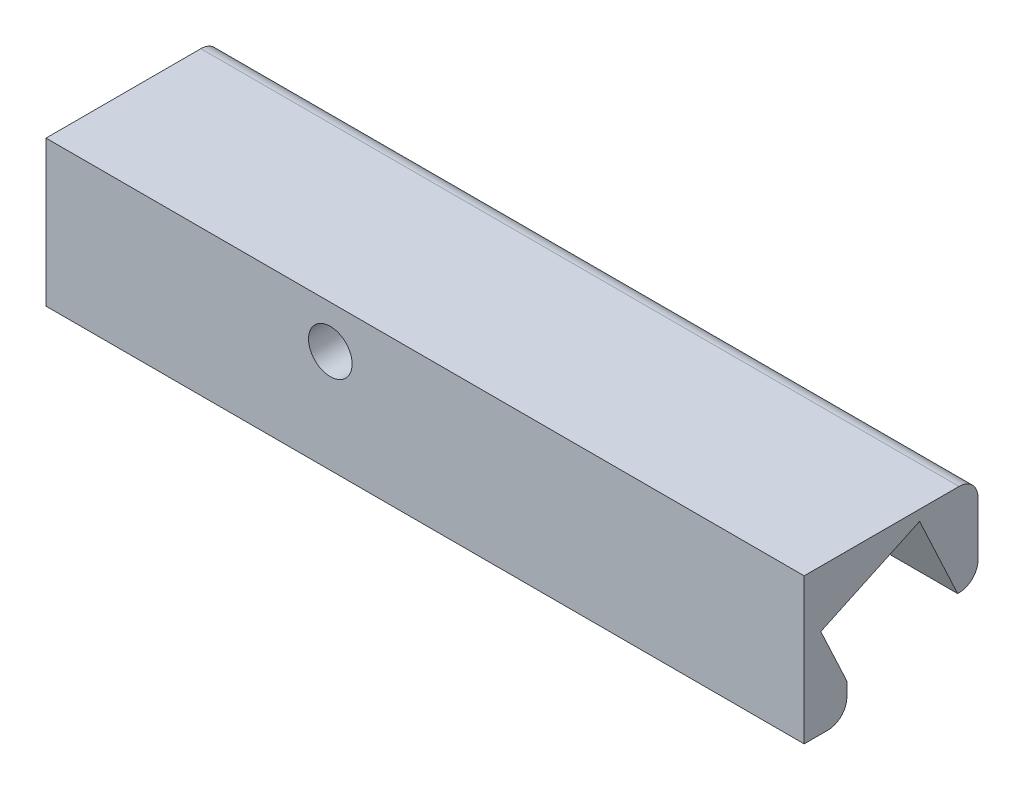
from build123d import *

# Parameters (mm, degrees)
PROFILEBOSS_EXTRUDE1_DEPTH           = 80
SKETCH2_R                            = 2.3
LEDSTRIPMOUNTHOLESCUT_EXTRUDE1_DEPTH = 4.5
SKETCH4_W                            = 28
SKETCH4_H                            = 11.5
POWERCONNECTORCUT_EXTRUDE4_DEPTH     = 6.5
SKETCH3_R                            = 2.3
MOUNTINGHOLESCUT_EXTRUDE3_DEPTH      = 4.5


with BuildPart() as part:
    # Sketch1 → ProfileBoss-Extrude1 (new body)
    with BuildSketch(Plane(origin=(0, 0, 0), x_dir=(0, 0, -1), z_dir=(1, 0, 0))):
        with BuildLine():
            Line((0, 0), (2.499461553, 0))
            ThreePointArc((2.499461553, 0), (3.914055855, 0.585944145), (4.5, 2.000538447))
            Line((4.5, 2.000538447), (4.5, 3.5))
            Line((4.5, 3.5), (14.922539551, 8.36011001))
            Line((14.922539551, 8.36011001), (16.190394336, 5.641186649))
            ThreePointArc((16.190394336, 5.641186649), (17.700753359, 6.16912635), (18.340729536, 7.635528477))
            Line((18.340729536, 7.635528477), (18.340729536, 13.36011001))
            ThreePointArc((18.340729536, 13.36011001), (17.754943098, 14.774323572), (16.340729536, 15.36011001))
            Line((16.340729536, 15.36011001), (0, 15.36011001))
            Line((0, 15.36011001), (0, 0))
        make_face()
    extrude(amount=PROFILEBOSS_EXTRUDE1_DEPTH)

    # Sketch2 → LedStripMountHolesCut-Extrude1 (cut)
    with BuildSketch(Plane(origin=(0, 1.15127832, 0.536849897), x_dir=(1, 0, 0), z_dir=(0, -0.906307787036651, -0.4226182617406973))):
        with Locations(Location((43.85, -11.307548958, 0), (0, 0, 270))):
            Circle(SKETCH2_R)
    extrude(amount=-LEDSTRIPMOUNTHOLESCUT_EXTRUDE1_DEPTH, mode=Mode.SUBTRACT)

    # Sketch4 → PowerConnectorCut-Extrude4 (cut)
    with BuildSketch(Plane(origin=(0, 1.15127832, 0.536849897), x_dir=(1, 0, 0), z_dir=(0, -0.906307787036651, -0.4226182617406973))):
        with Locations((66, -11.307548958)):
            Rectangle(SKETCH4_W, SKETCH4_H)
    extrude(amount=-POWERCONNECTORCUT_EXTRUDE4_DEPTH, mode=Mode.SUBTRACT)

    # Sketch3 → MountingHolesCut-Extrude3 (cut)
    with BuildSketch(Plane.XY):
        with Locations((30, 10.86011001)):
            Circle(SKETCH3_R)
    extrude(amount=-MOUNTINGHOLESCUT_EXTRUDE3_DEPTH, mode=Mode.SUBTRACT)


solid = part.part
